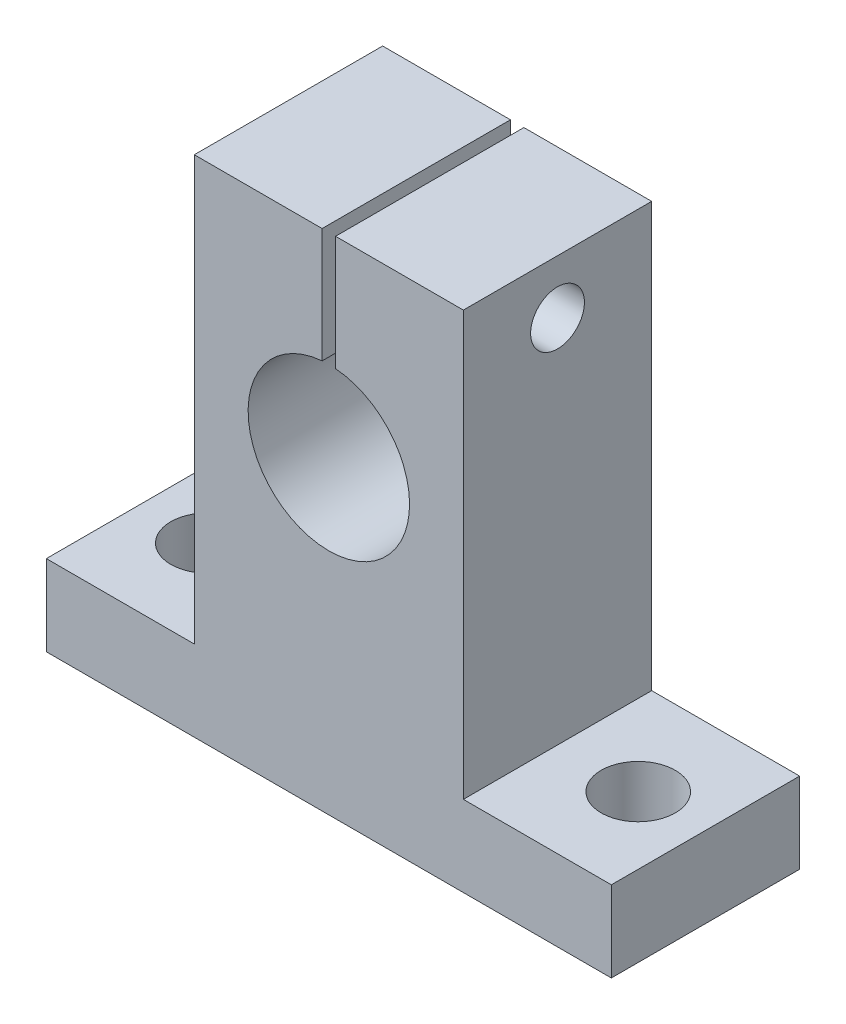
from build123d import *

# Parameters (mm, degrees)
SKETCH1_R           = 6
BOSS_EXTRUDE1_DEPTH = 14
SKETCH3_W           = 1
SKETCH3_H           = 16.490173319
CUT_EXTRUDE1_DEPTH  = 19
SKETCH2_R           = 2
CUT_EXTRUDE3_DEPTH  = 31
SKETCH5_R           = 2.75
CUT_EXTRUDE5_DEPTH  = 22


with BuildPart() as part:
    # Sketch1 → Boss-Extrude1 (new body)
    with BuildSketch(Plane.XY):
        Polygon((-21, 0), (21, 0), (21, 6), (10, 6), (10, 37.5), (-10, 37.5), (-10, 6), (-21, 6), align=None)
        with Locations((0, 23)):
            Circle(SKETCH1_R, mode=Mode.SUBTRACT)
    extrude(amount=BOSS_EXTRUDE1_DEPTH)

    # Sketch3 → Cut-Extrude1 (cut)
    with BuildSketch(Plane.XY.offset(14)):
        with Locations((0, 29.25491334)):
            Rectangle(SKETCH3_W, SKETCH3_H)
    extrude(amount=-CUT_EXTRUDE1_DEPTH, mode=Mode.SUBTRACT)

    # Sketch2 → Cut-Extrude3 (cut)
    with BuildSketch(Plane(origin=(10, 0, 0), x_dir=(0, 0, -1), z_dir=(1, 0, 0))):
        with Locations((-7, 33.5)):
            Circle(SKETCH2_R)
    extrude(amount=-CUT_EXTRUDE3_DEPTH, mode=Mode.SUBTRACT)

    # Sketch5 → Cut-Extrude5 (cut)
    with BuildSketch(Plane(origin=(0, 6, 0), x_dir=(1, 0, 0), z_dir=(0, 1, 0))):
        with Locations(Location((16, -7, 0), (0, 0, 180))):
            Circle(SKETCH5_R)
        with Locations(Location((-16, -7, 0), (0, 0, 180))):
            Circle(SKETCH5_R)
    extrude(amount=-CUT_EXTRUDE5_DEPTH, mode=Mode.SUBTRACT)


solid = part.part
